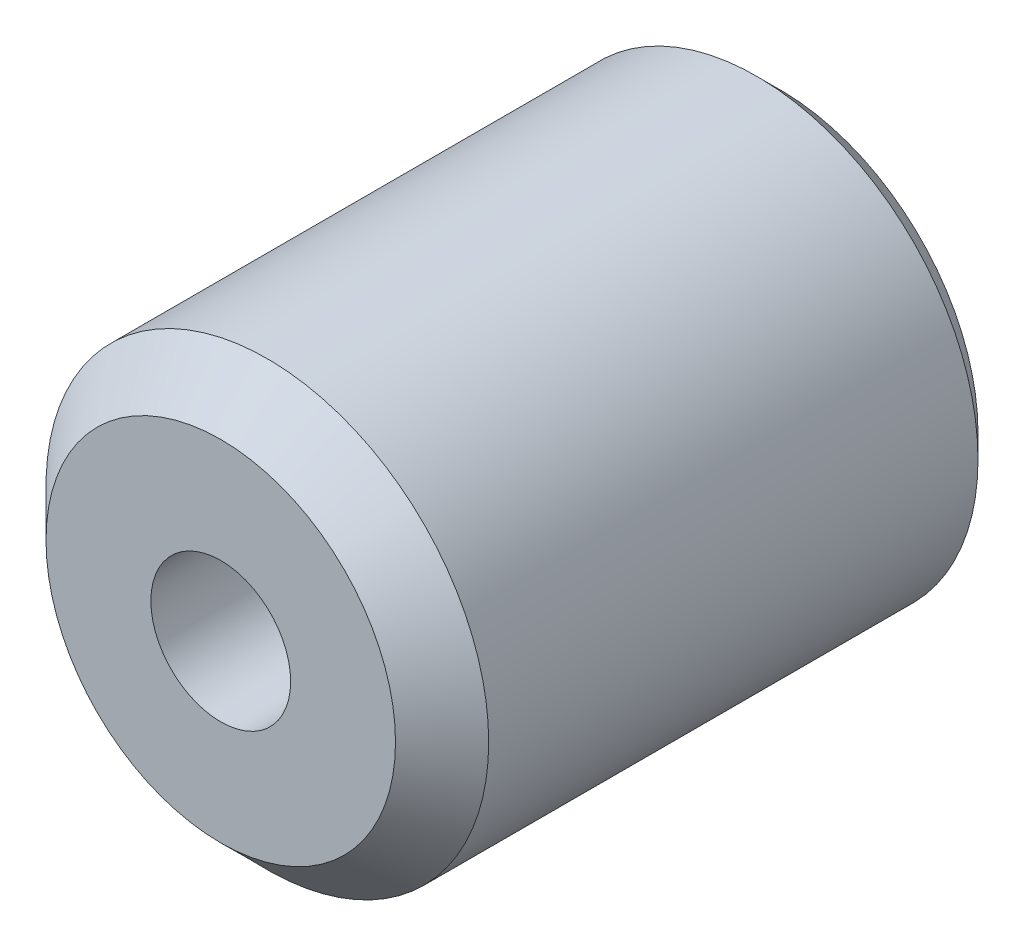
from build123d import *

# Parameters (mm, degrees)
SKETCH1_R           = 9.5
BOSS_EXTRUDE1_DEPTH = 12
CHAMFER1_SIZE       = 2
CHAMFER2_SIZE       = 1
SKETCH2_R           = 7
CUT_EXTRUDE1_DEPTH  = 14
SKETCH3_R           = 3
CUT_EXTRUDE2_DEPTH  = 14


with BuildPart() as part:
    # Sketch1 → Boss-Extrude1 (new, symmetric)
    with BuildSketch(Plane.XY):
        Circle(SKETCH1_R)
    extrude(amount=BOSS_EXTRUDE1_DEPTH, both=True)

    # Chamfer1
    chamfer1_edges = [part.edges().sort_by_distance(p)[0] for p in [
        (-9.5, 0, 12),
    ]]
    chamfer(chamfer1_edges, length=CHAMFER1_SIZE)

    # Chamfer2
    chamfer2_edges = [part.edges().sort_by_distance(p)[0] for p in [
        (-9.5, 0, -12),
    ]]
    chamfer(chamfer2_edges, length=CHAMFER2_SIZE)

    # Sketch2 → Cut-Extrude1 (cut)
    with BuildSketch(Plane(origin=(0, 0, -12), x_dir=(-1, 0, 0), z_dir=(0, 0, -1))):
        Circle(SKETCH2_R)
    extrude(amount=-CUT_EXTRUDE1_DEPTH, mode=Mode.SUBTRACT)

    # Sketch3 → Cut-Extrude2 (cut)
    with BuildSketch(Plane(origin=(0, 0, 2), x_dir=(-1, 0, 0), z_dir=(0, 0, -1))):
        Circle(SKETCH3_R)
    extrude(amount=-CUT_EXTRUDE2_DEPTH, mode=Mode.SUBTRACT)


solid = part.part
